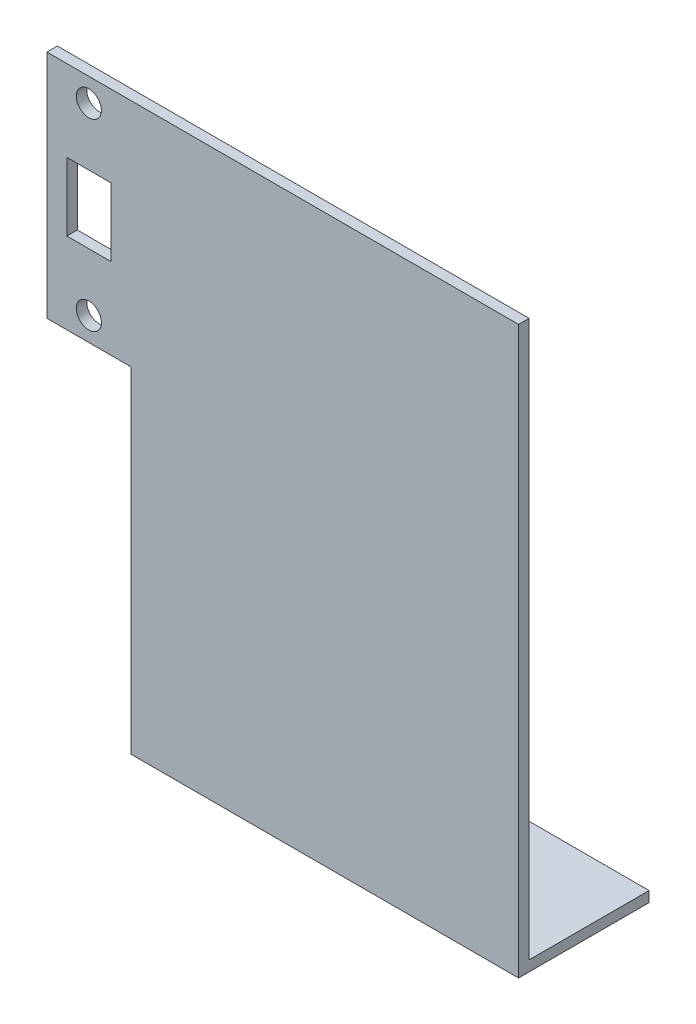
from build123d import *

# Parameters (mm, degrees)
BOSS_EXTRUDE1_DEPTH = 1
SKETCH2_R           = 1.2
SKETCH2_W           = 4.2
SKETCH2_H           = 6.5
CUT_EXTRUDE1_DEPTH  = 11
SKETCH3_W           = 37
SKETCH3_H           = 1
BOSS_EXTRUDE2_DEPTH = 11.45


with BuildPart() as part:
    # Sketch1 → Boss-Extrude1 (new body)
    with BuildSketch(Plane.XY):
        Polygon((18.5, 23.5), (18.5, 30.5), (-18.5, 30.5), (-26.5, 30.5), (-26.5, 8.5), (-18.5, 8.5), (-18.5, -23.5), (18.5, -23.5), align=None)
    extrude(amount=BOSS_EXTRUDE1_DEPTH)

    # Sketch2 → Cut-Extrude1 (cut)
    with BuildSketch(Plane.XY.offset(1)):
        with Locations((-22.5, 10.735)):
            Circle(SKETCH2_R)
        with Locations((-22.5, 28.265)):
            Circle(SKETCH2_R)
        with Locations((-22.5, 19.5)):
            Rectangle(SKETCH2_W, SKETCH2_H)
    extrude(amount=-CUT_EXTRUDE1_DEPTH, mode=Mode.SUBTRACT)

    # Sketch3 → Boss-Extrude2 (add)
    with BuildSketch(Plane(origin=(0, 0, 0), x_dir=(-1, 0, 0), z_dir=(0, 0, -1))):
        with Locations((0, -23)):
            Rectangle(SKETCH3_W, SKETCH3_H)
    extrude(amount=BOSS_EXTRUDE2_DEPTH)


solid = part.part
